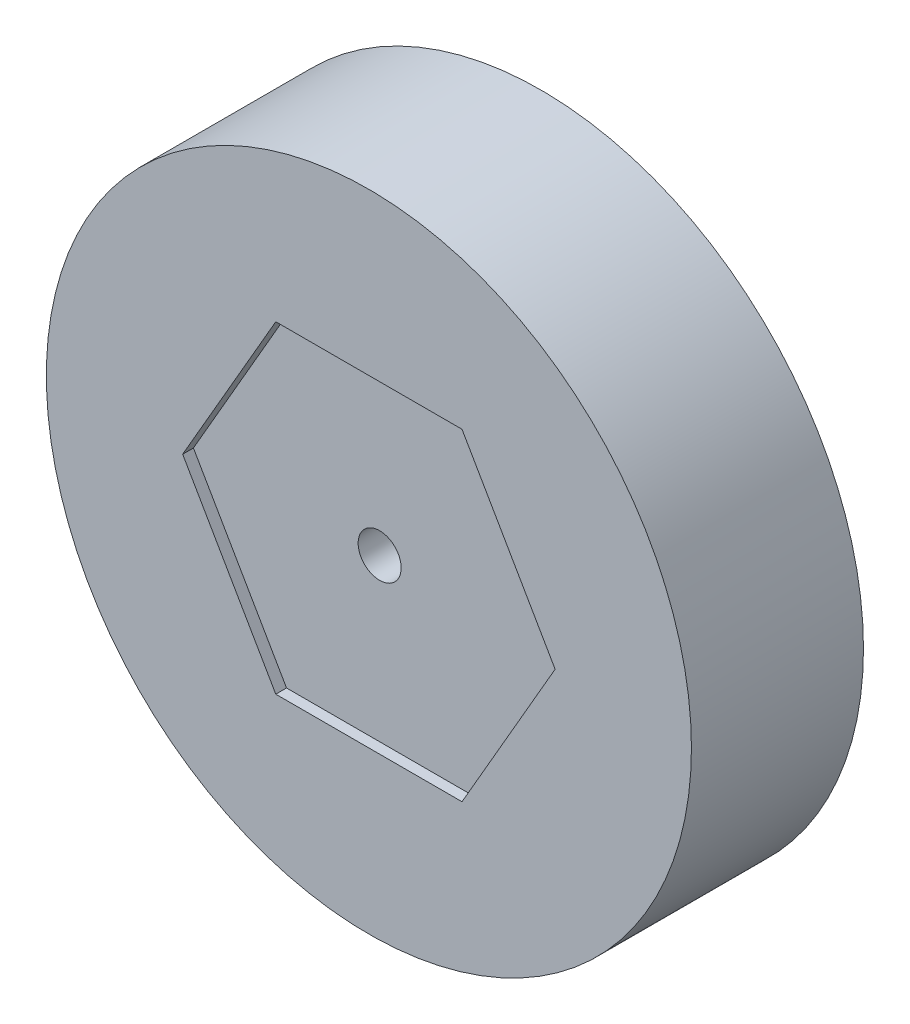
from build123d import *

# Parameters (mm, degrees)
SKETCH1_R           = 15
SKETCH1_R_2         = 1
BOSS_EXTRUDE1_DEPTH = 4
CUT_EXTRUDE1_DEPTH  = 0.5


with BuildPart() as part:
    # Sketch1 → Boss-Extrude1 (new, symmetric)
    with BuildSketch(Plane.XY):
        Circle(SKETCH1_R)
        Circle(SKETCH1_R_2, mode=Mode.SUBTRACT)
    extrude(amount=BOSS_EXTRUDE1_DEPTH, both=True)

    # Sketch2 → Cut-Extrude1 (cut)
    with BuildSketch(Plane.XY.offset(4)):
        Polygon((-4.330127019, 7.5), (-8.660254038, 0), (-4.330127019, -7.5), (4.330127019, -7.5), (8.660254038, 0), (4.330127019, 7.5), align=None)
    extrude(amount=-CUT_EXTRUDE1_DEPTH, mode=Mode.SUBTRACT)


solid = part.part
